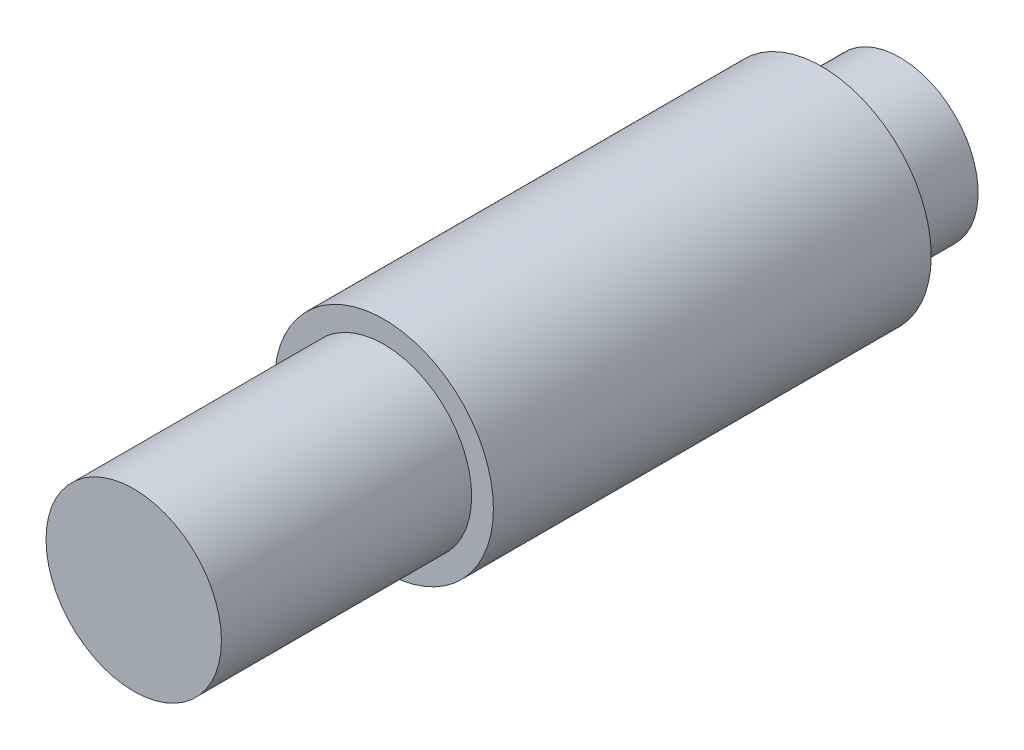
from build123d import *

# Parameters (mm, degrees)
SKETCH1_R           = 17.5
BOSS_EXTRUDE1_DEPTH = 70
SKETCH2_R           = 14.025
BOSS_EXTRUDE2_DEPTH = 40
SKETCH4_R           = 12.5
BOSS_EXTRUDE3_DEPTH = 12.5


with BuildPart() as part:
    # Sketch1 → Boss-Extrude1 (new body)
    with BuildSketch(Plane.XY):
        Circle(SKETCH1_R)
    extrude(amount=BOSS_EXTRUDE1_DEPTH)

    # Sketch2 → Boss-Extrude2 (add)
    with BuildSketch(Plane.XY.offset(70)):
        Circle(SKETCH2_R)
    extrude(amount=BOSS_EXTRUDE2_DEPTH)

    # Sketch4 → Boss-Extrude3 (add)
    with BuildSketch(Plane(origin=(0, 0, 0), x_dir=(-1, 0, 0), z_dir=(0, 0, -1))):
        Circle(SKETCH4_R)
    extrude(amount=BOSS_EXTRUDE3_DEPTH)


solid = part.part
